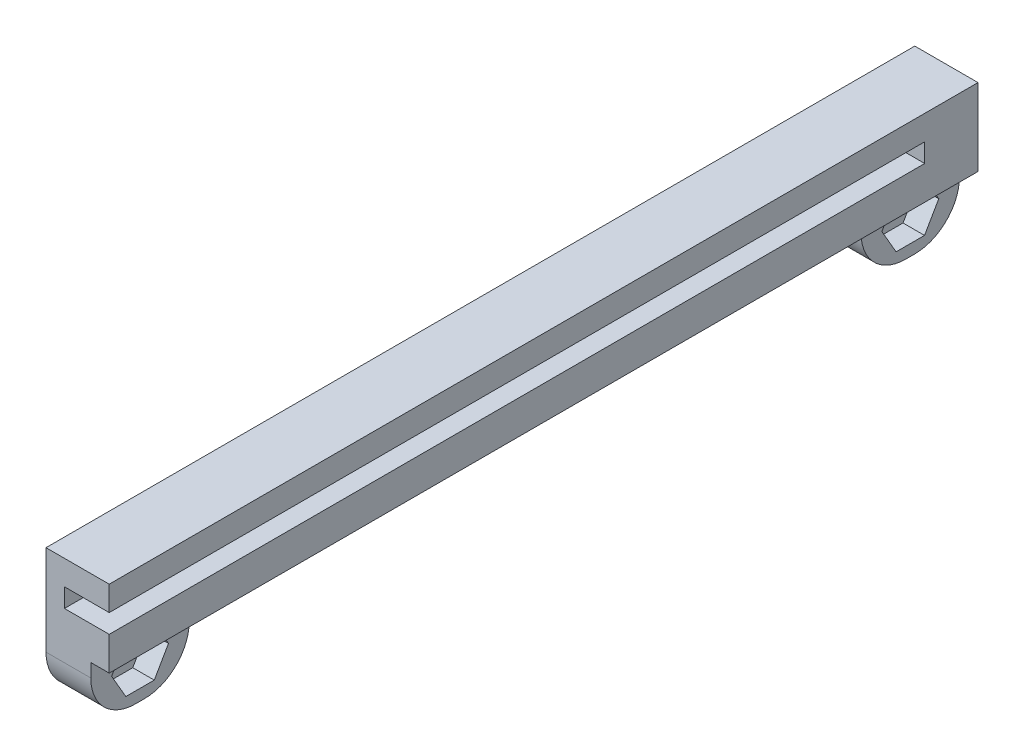
from build123d import *

# Parameters (mm, degrees)
SKETCH1_W           = 7.0575
SKETCH1_H           = 97
BOSS_EXTRUDE2_DEPTH = 7.6
SKETCH4_W           = 5
SKETCH4_H           = 91.05
CUT_EXTRUDE1_DEPTH  = 4.85
SKETCH6_W           = 5
SKETCH6_H           = 91.05
BOSS_EXTRUDE3_DEPTH = 2.75
SKETCH8_W           = 7.0575
SKETCH8_H           = 97
BOSS_EXTRUDE4_DEPTH = 1
SKETCH9_W           = 5
SKETCH9_H           = 11
BOSS_EXTRUDE5_DEPTH = 6.5
CUT_EXTRUDE2_DEPTH  = 2.4
SKETCH11_R          = 1.85
CUT_EXTRUDE3_DEPTH  = 50.293805962
FILLET2_R           = 5


with BuildPart() as part:
    # Sketch1 → Boss-Extrude2 (new body)
    with BuildSketch(Plane(origin=(0, 0, 0), x_dir=(1, 0, 0), z_dir=(0, 1, 0))):
        Rectangle(SKETCH1_W, SKETCH1_H)
    extrude(amount=BOSS_EXTRUDE2_DEPTH)

    # Sketch4 → Cut-Extrude1 (cut)
    with BuildSketch(Plane(origin=(0, 7.6, 0), x_dir=(1, 0, 0), z_dir=(0, 1, 0))):
        with Locations((1.02875, -2.975)):
            Rectangle(SKETCH4_W, SKETCH4_H)
    extrude(amount=-CUT_EXTRUDE1_DEPTH, mode=Mode.SUBTRACT)

    # Sketch6 → Boss-Extrude3 (add)
    with BuildSketch(Plane(origin=(0, 7.6, 0), x_dir=(1, 0, 0), z_dir=(0, 1, 0))):
        with Locations((1.02875, -2.975)):
            Rectangle(SKETCH6_W, SKETCH6_H)
    extrude(amount=-BOSS_EXTRUDE3_DEPTH)

    # Sketch8 → Boss-Extrude4 (add)
    with BuildSketch(Plane.XZ):
        Rectangle(SKETCH8_W, SKETCH8_H)
    extrude(amount=BOSS_EXTRUDE4_DEPTH)

    # Sketch9 → Boss-Extrude5 (add)
    with BuildSketch(Plane.XZ.offset(1)):
        with Locations((-1.02875, 43)):
            Rectangle(SKETCH9_W, SKETCH9_H)
        with Locations((-1.02875, -43)):
            Rectangle(SKETCH9_W, SKETCH9_H)
    extrude(amount=BOSS_EXTRUDE5_DEPTH)

    # Sketch10 → Cut-Extrude2 (cut)
    with BuildSketch(Plane(origin=(1.47125, 0, 0), x_dir=(0, 0, -1), z_dir=(1, 0, 0))):
        Polygon((-44.58771324, -0.75), (-46.175426481, -3.5), (-44.58771324, -6.25), (-41.41228676, -6.25), (-39.824573519, -3.5), (-41.41228676, -0.75), align=None)
        Polygon((46.175426481, -3.5), (44.58771324, -0.75), (41.41228676, -0.75), (39.824573519, -3.5), (41.41228676, -6.25), (44.58771324, -6.25), align=None)
    extrude(amount=-CUT_EXTRUDE2_DEPTH, mode=Mode.SUBTRACT)

    # Sketch11 → Cut-Extrude3 (cut, through all)
    with BuildSketch(Plane(origin=(-0.92875, 0, 0), x_dir=(0, 0, -1), z_dir=(1, 0, 0))):
        with Locations((-43, -3.5)):
            Circle(SKETCH11_R)
        with Locations((43, -3.5)):
            Circle(SKETCH11_R)
    extrude(amount=-CUT_EXTRUDE3_DEPTH, mode=Mode.SUBTRACT)

    # Fillet2
    fillet2_edges = [part.edges().sort_by_distance(p)[0] for p in [
        (-1.02875, -7.5, 48.5),
        (-1.02875, -7.5, 37.5),
        (-1.02875, -7.5, -37.5),
        (-1.02875, -7.5, -48.5),
    ]]
    fillet(fillet2_edges, radius=FILLET2_R)


solid = part.part
